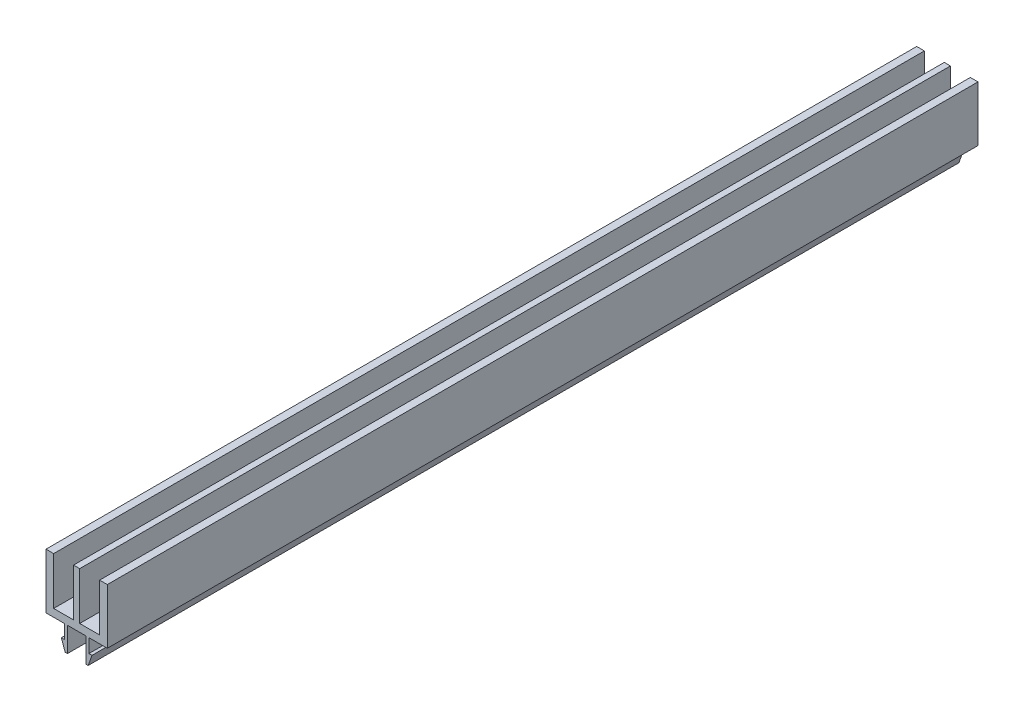
from build123d import *

# Parameters (mm, degrees)
BOSS_EXTRU_1_DEPTH = 284


with BuildPart() as part:
    # Esquisse1 → Boss.-Extru.1 (new body)
    with BuildSketch(Plane.XY.offset(50)):
        Polygon((-1, 2.5), (-7.5, 2.5), (-7.5, 17.999999998), (-10, 17.999999998), (-10, 0), (-4, 0), (-4, -4.5), (-5, -4.5), (-3.75, -8), (-3, -8), (-3, 0), (3, 0), (3, -8), (3.75, -8), (5, -4.5), (4, -4.5), (4, 0), (10, 0), (10, 17.999999998), (7.5, 17.999999998), (7.5, 2.5), (1, 2.5), (1, 17.999999998), (-1, 17.999999998), align=None)
    extrude(amount=-BOSS_EXTRU_1_DEPTH)


solid = part.part
